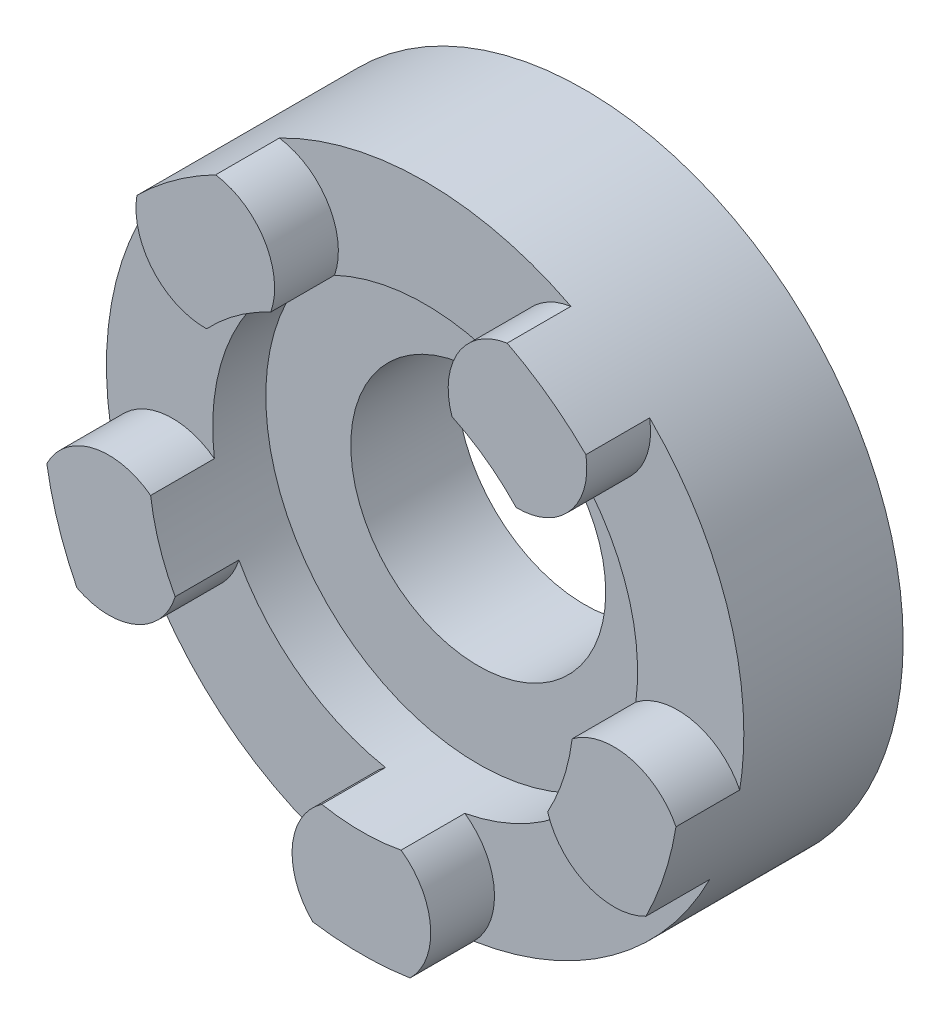
from build123d import *
from build123d.topology import SkipClean

# Parameters (mm, degrees)
SKETCH1_R           = 15
SKETCH1_R_2         = 10
SKETCH1_R_3         = 6
BOSS_EXTRUDE1_DEPTH = 5
BOSS_EXTRUDE2_START = 2.5
SKETCH2_R           = 15
SKETCH2_R_2         = 10
BOSS_EXTRUDE2_DEPTH = 2.5
BOSS_EXTRUDE4_START = 3
BOSS_EXTRUDE4_DEPTH = 3


with BuildPart() as part:
    # Sketch1 → Boss-Extrude1 (new body)
    # profile 1 of 2: a face of its own
    with BuildSketch(Plane.XY):
        Circle(SKETCH1_R)
        Circle(SKETCH1_R_2, mode=Mode.SUBTRACT)
    # profile 2 of 2: a face of its own
    with BuildSketch(Plane.XY):
        Circle(SKETCH1_R_2)
        Circle(SKETCH1_R_3, mode=Mode.SUBTRACT)
    extrude(amount=-BOSS_EXTRUDE1_DEPTH)

    # Sketch2 → Boss-Extrude2 (add)
    with BuildSketch(Plane.XY.offset(BOSS_EXTRUDE2_START)):
        Circle(SKETCH2_R)
        Circle(SKETCH2_R_2, mode=Mode.SUBTRACT)
    extrude(amount=-BOSS_EXTRUDE2_DEPTH)

    # Sketch3 → Boss-Extrude4 (add)
    with SkipClean():  # the faces are left unmerged after this step: merging them gives an invalid solid
        with BuildSketch(Plane.XY.offset(2.5).offset(BOSS_EXTRUDE4_START)):
            with BuildLine():
                ThreePointArc((-2.290603582, -14.824072829), (0, -15), (2.290603582, -14.824072829))
                ThreePointArc((2.290603582, -14.824072829), (3.086155614, -13.560105094), (3.235238064, -12.074072829))
                ThreePointArc((3.235238064, -12.074072829), (2.788392741, -10.80499404), (1.867509855, -9.824072829))
                ThreePointArc((1.867509855, -9.824072829), (0, -10), (-1.867509855, -9.824072829))
                ThreePointArc((-1.867509855, -9.824072829), (-2.788392741, -10.80499404), (-3.235238064, -12.074072829))
                ThreePointArc((-3.235238064, -12.074072829), (-3.086155614, -13.560105094), (-2.290603582, -14.824072829))
            make_face()
            with BuildLine():
                ThreePointArc((-14.806366496, -2.402396967), (-14.265847744, -4.635254916), (-13.390695627, -6.759383893))
                ThreePointArc((-13.390695627, -6.759383893), (-11.942751779, -7.125411327), (-10.483382099, -6.807987938))
                ThreePointArc((-10.483382099, -6.807987938), (-9.414499246, -5.990845869), (-8.766156198, -4.811912875))
                ThreePointArc((-8.766156198, -4.811912875), (-9.510565163, -3.090169944), (-9.920340763, -1.259698041))
                ThreePointArc((-9.920340763, -1.259698041), (-11.137820734, -0.687007696), (-12.482869184, -0.654199453))
                ThreePointArc((-12.482869184, -0.654199453), (-13.850100843, -1.255194512), (-14.806366496, -2.402396967))
            make_face()
            with BuildLine():
                ThreePointArc((-6.860234162, 13.339309849), (-8.816778784, 12.135254916), (-10.566508613, 10.64654384))
                ThreePointArc((-10.566508613, 10.64654384), (-10.467182133, 9.15635871), (-9.714324518, 7.866504888))
                ThreePointArc((-9.714324518, 7.866504888), (-8.606873263, 7.102447672), (-7.285292336, 6.850147121))
                ThreePointArc((-7.285292336, 6.850147121), (-5.877852523, 8.090169944), (-4.263597916, 9.045536624))
                ThreePointArc((-4.263597916, 9.045536624), (-4.095159033, 10.380399934), (-4.479599369, 11.669755331))
                ThreePointArc((-4.479599369, 11.669755331), (-5.473677455, 12.784352223), (-6.860234162, 13.339309849))
            make_face()
            with BuildLine():
                ThreePointArc((10.566508613, 10.64654384), (8.816778784, 12.135254916), (6.860234162, 13.339309849))
                ThreePointArc((6.860234162, 13.339309849), (5.473677455, 12.784352223), (4.479599369, 11.669755331))
                ThreePointArc((4.479599369, 11.669755331), (4.095159033, 10.380399934), (4.263597916, 9.045536624))
                ThreePointArc((4.263597916, 9.045536624), (5.877852523, 8.090169944), (7.285292336, 6.850147121))
                ThreePointArc((7.285292336, 6.850147121), (8.606873263, 7.102447672), (9.714324518, 7.866504888))
                ThreePointArc((9.714324518, 7.866504888), (10.467182133, 9.15635871), (10.566508613, 10.64654384))
            make_face()
            with BuildLine():
                ThreePointArc((13.390695627, -6.759383893), (14.265847744, -4.635254916), (14.806366496, -2.402396967))
                ThreePointArc((14.806366496, -2.402396967), (13.850100843, -1.255194512), (12.482869184, -0.654199453))
                ThreePointArc((12.482869184, -0.654199453), (11.137820734, -0.687007696), (9.920340763, -1.259698041))
                ThreePointArc((9.920340763, -1.259698041), (9.510565163, -3.090169944), (8.766156198, -4.811912875))
                ThreePointArc((8.766156198, -4.811912875), (9.414499246, -5.990845869), (10.483382099, -6.807987938))
                ThreePointArc((10.483382099, -6.807987938), (11.942751779, -7.125411327), (13.390695627, -6.759383893))
            make_face()
        extrude(amount=-BOSS_EXTRUDE4_DEPTH)


solid = part.part
